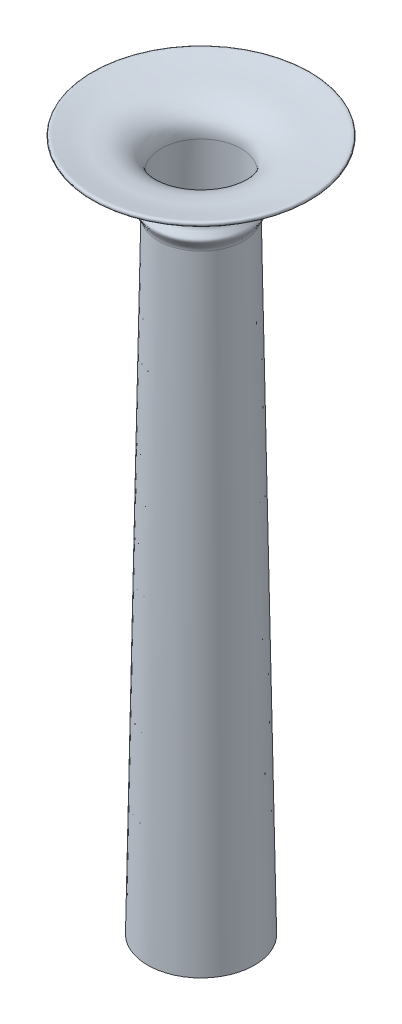
from build123d import *


with BuildPart() as part:
    # Sketch1 → Revolve1 (revolve)
    with BuildSketch(Plane.XY, mode=Mode.PRIVATE) as revolve1_sk:
        with BuildLine():
            Line((-12.5, 0), (-9.696811606, 160.594555534))
            add(Edge.make_bspline(
                [(-9.696811606, 160.594555534), (-9.667165677, 162.292969697), (-10.486474841, 164.306904024), (-16.127775715, 167.89961041), (-20.223282178, 166.810519428), (-26.496953336, 168.759464307), (-26.522935658, 167.692435245), (-25.742807529, 167.272952369), (-24.374375442, 167.742269988), (-20.943251814, 166.727581792), (-15.641433914, 167.397666688), (-9.09004311, 162.483051317), (-10.8820492, 159.060921848), (-10.270495232, 157.544190843), (-10.068819251, 155.580238233), (-12.120258118, 154.371924787), (-10.963160869, 152.727148493), (-10.351048609, 151.758323561), (-10.361768703, 151.144169777)],
                knots=[0, 0, 0, 0, 0.082451052, 0.139496152, 0.376690168, 0.407776512, 0.416580187, 0.430441824, 0.45314311, 0.501080205, 0.637252853, 0.800463783, 0.82601952, 0.852885947, 0.896023812, 0.934070446, 0.960310185, 1, 1, 1, 1], degree=3))
            Line((-10.361768703, 151.144169777), (-13, 0))
            Line((-13, 0), (-12.5, 0))
        make_face()
    revolve(revolve1_sk.sketch.rotate(Axis((0, 0, 0), (0, 1, 0)), 270), axis=Axis((0, 0, 0), (0, 1, 0)))


solid = part.part
